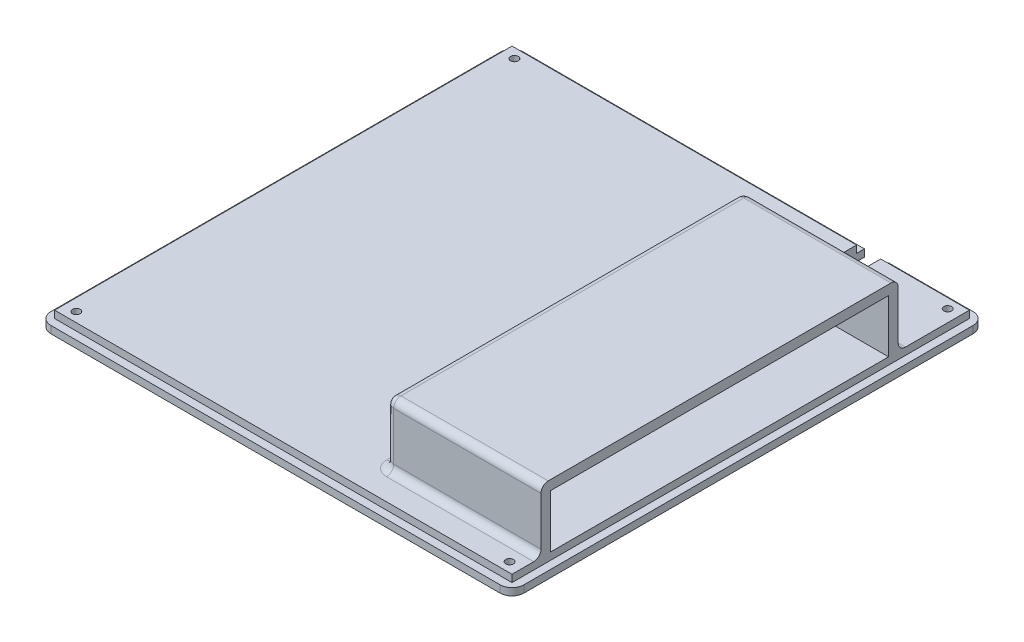
from build123d import *

# Parameters (mm, degrees)
SKETCH1_W               = 196
SKETCH1_H               = 196
BOSS_EXTRUDE1_DEPTH     = 3
FILLET1_R               = 5
SKETCH2_W               = 189.5
SKETCH2_H               = 189.5
BOSS_EXTRUDE2_DEPTH     = 6
SKETCH3_R               = 1.6
CUT_EXTRUDE1_DEPTH      = 139.722745071
SKETCH5_R               = 3
CUT_EXTRUDE5_DEPTH      = 2
MIRROR2_COPY_1_SKETCH_R = 1.6
MIRROR2_COPY_1_DEPTH    = 139.722745071
MIRROR2_COPY_2_SKETCH_R = 3
MIRROR2_COPY_2_DEPTH    = 2
BOSS_EXTRUDE3_DEPTH     = 22
SKETCH7_W               = 64
SKETCH7_H               = 148
BOSS_EXTRUDE4_DEPTH     = 4
FILLET2_R               = 3
CUT_EXTRUDE6_REACH      = 166.938
SKETCH8_W               = 50
SKETCH8_H               = 15
CUT_EXTRUDE7_REACH      = 195.077
SKETCH10_W              = 20
SKETCH10_H              = 15
CUT_EXTRUDE8_DEPTH      = 143.239235094


with BuildPart() as part:
    # Sketch1 → Boss-Extrude1 (new body)
    with BuildSketch(Plane(origin=(0, 0, 0), x_dir=(1, 0, 0), z_dir=(0, 1, 0))):
        Rectangle(SKETCH1_W, SKETCH1_H)
    extrude(amount=BOSS_EXTRUDE1_DEPTH)

    # Fillet1
    fillet1_edges = [part.edges().sort_by_distance(p)[0] for p in [
        (-98, 1.5, -98),
        (-98, 1.5, 98),
        (98, 1.5, 98),
        (98, 1.5, -98),
    ]]
    fillet(fillet1_edges, radius=FILLET1_R)

    # Sketch2 → Boss-Extrude2 (add)
    with BuildSketch(Plane.XZ):
        Rectangle(SKETCH2_W, SKETCH2_H)
    extrude(amount=-BOSS_EXTRUDE2_DEPTH)

    # Sketch3 → Cut-Extrude1 (cut, through all)
    with BuildSketch(Plane(origin=(0, 6, 0), x_dir=(1, 0, 0), z_dir=(0, 1, 0))):
        with Locations(Location((-89.75, 90.75, 0), (0, 0, 270))):
            Circle(SKETCH3_R)
    cut_extrude1 = extrude(amount=-CUT_EXTRUDE1_DEPTH, mode=Mode.SUBTRACT)

    # Sketch5 → Cut-Extrude5 (cut)
    with BuildSketch(Plane.XZ):
        with Locations(Location((-89.75, -90.75, 0), (0, 0, 270))):
            Circle(SKETCH5_R)
    cut_extrude5 = extrude(amount=-CUT_EXTRUDE5_DEPTH, mode=Mode.SUBTRACT)

    # Mirror1: Cut-Extrude1, Cut-Extrude5 across plane
    add(cut_extrude1.mirror(Plane.XY), mode=Mode.SUBTRACT)
    add(cut_extrude5.mirror(Plane.XY), mode=Mode.SUBTRACT)

    # Mirror2: Cut-Extrude1, Cut-Extrude5 across plane
    add(cut_extrude1.mirror(Plane(origin=(0, 0, 0), x_dir=(0, 0, 1), z_dir=(1, 0, 0))), mode=Mode.SUBTRACT)
    add(cut_extrude5.mirror(Plane(origin=(0, 0, 0), x_dir=(0, 0, 1), z_dir=(1, 0, 0))), mode=Mode.SUBTRACT)

    # Mirror2 copy 1 sketch → Mirror2 copy 1 (cut, through all)
    with BuildSketch(Plane(origin=(0, 6, 0), x_dir=(-1, 0, 0), z_dir=(0, 1, 0))):
        with Locations(Location((-89.75, 90.75, 0), (0, 0, 270))):
            Circle(MIRROR2_COPY_1_SKETCH_R)
    extrude(amount=-MIRROR2_COPY_1_DEPTH, mode=Mode.SUBTRACT)

    # Mirror2 copy 2 sketch → Mirror2 copy 2 (cut)
    with BuildSketch(Plane(origin=(0, 0, 0), x_dir=(-1, 0, 0), z_dir=(0, -1, 0))):
        with Locations(Location((-89.75, -90.75, 0), (0, 0, 270))):
            Circle(MIRROR2_COPY_2_SKETCH_R)
    extrude(amount=-MIRROR2_COPY_2_DEPTH, mode=Mode.SUBTRACT)

    # Sketch6 → Boss-Extrude3 (add)
    with BuildSketch(Plane(origin=(0, 6, 0), x_dir=(1, 0, 0), z_dir=(0, 1, 0))):
        Polygon((94.75, -82.75), (94.75, -78.75), (34.75, -78.75), (34.75, 61.25), (94.75, 61.25), (94.75, 65.25), (30.75, 65.25), (30.75, -82.75), align=None)
    extrude(amount=BOSS_EXTRUDE3_DEPTH)

    # Sketch7 → Boss-Extrude4 (add)
    with BuildSketch(Plane(origin=(0, 28, 0), x_dir=(1, 0, 0), z_dir=(0, 1, 0))):
        with Locations((62.75, -8.75)):
            Rectangle(SKETCH7_W, SKETCH7_H)
    extrude(amount=BOSS_EXTRUDE4_DEPTH)

    # Fillet2
    fillet2_edges = [part.edges().sort_by_distance(p)[0] for p in [
        (62.75, 6, 82.75),
        (30.75, 19, 82.75),
        (62.75, 6, -65.25),
        (30.75, 6, 8.75),
        (30.75, 19, -65.25),
        (30.75, 32, 8.75),
        (62.75, 32, 82.75),
        (62.75, 32, -65.25),
    ]]
    fillet(fillet2_edges, radius=FILLET2_R)

    # Sketch8 → Cut-Extrude6 (cut, up to next)
    with BuildSketch(Plane.ZY.offset(-30.75), mode=Mode.PRIVATE) as cut_extrude6_sk1:
        with Locations((-25.25, 17.5)):
            Rectangle(SKETCH8_W, SKETCH8_H)
    cut_extrude6_tool1 = extrude(cut_extrude6_sk1.sketch, amount=-CUT_EXTRUDE6_REACH, mode=Mode.PRIVATE) & part.part
    add(cut_extrude6_tool1.solids().sort_by_distance((30.75, 17.5, -25.25))[0], mode=Mode.SUBTRACT)

    # Sketch10 → Cut-Extrude7 (cut, up to next)
    with BuildSketch(Plane(origin=(0, 0, -65.25), x_dir=(-1, 0, 0), z_dir=(0, 0, -1)), mode=Mode.PRIVATE) as cut_extrude7_sk1:
        with Locations((-45.75, 17.5)):
            Rectangle(SKETCH10_W, SKETCH10_H)
    cut_extrude7_tool1 = extrude(cut_extrude7_sk1.sketch, amount=-CUT_EXTRUDE7_REACH, mode=Mode.PRIVATE) & part.part
    add(cut_extrude7_tool1.solids().sort_by_distance((45.75, 17.5, -65.25))[0], mode=Mode.SUBTRACT)

    # Sketch11 → Cut-Extrude8 (cut, through all)
    with BuildSketch(Plane.XZ):
        with BuildLine():
            Line((58, -98), (48, -98))
            Line((48, -98), (48, -83))
            ThreePointArc((48, -83), (53, -78), (58, -83))
            Line((58, -83), (58, -98))
        make_face()
    extrude(amount=-CUT_EXTRUDE8_DEPTH, mode=Mode.SUBTRACT)


solid = part.part
